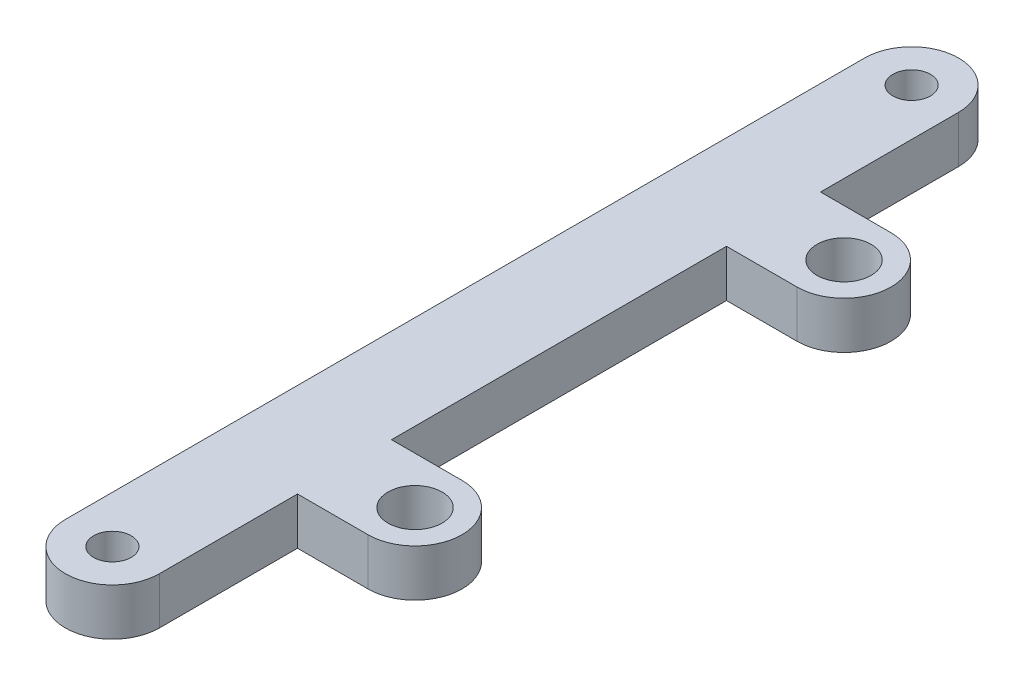
from build123d import *

# Parameters (mm, degrees)
SKETCH1_R           = 1.6
SKETCH1_R_2         = 2.3
BOSS_EXTRUDE1_DEPTH = 4


with BuildPart() as part:
    # Sketch1 → Boss-Extrude1 (new body)
    with BuildSketch(Plane(origin=(0, 0, 0), x_dir=(1, 0, 0), z_dir=(0, 1, 0))):
        with BuildLine():
            Line((-4, 68), (-4, 0))
            ThreePointArc((-4, 0), (0, -4), (4, 0))
            Line((4, 0), (4, 11.75))
            Line((4, 11.75), (10, 11.75))
            ThreePointArc((10, 11.75), (14, 15.75), (10, 19.75))
            Line((10, 19.75), (4, 19.75))
            Line((4, 19.75), (4, 48.25))
            Line((4, 48.25), (10, 48.25))
            ThreePointArc((10, 48.25), (14, 52.25), (10, 56.25))
            Line((10, 56.25), (4, 56.25))
            Line((4, 56.25), (4, 68))
            ThreePointArc((4, 68), (0, 72), (-4, 68))
        make_face()
        with Locations(Location((0, 68, 0), (0, 0, 270))):
            Circle(SKETCH1_R, mode=Mode.SUBTRACT)
        with Locations(Location((0, 0, 0), (0, 0, 270))):
            Circle(SKETCH1_R, mode=Mode.SUBTRACT)
        with Locations(Location((10, 52.25, 0), (0, 0, 270))):
            Circle(SKETCH1_R_2, mode=Mode.SUBTRACT)
        with Locations(Location((10, 15.75, 0), (0, 0, 90))):
            Circle(SKETCH1_R_2, mode=Mode.SUBTRACT)
    extrude(amount=BOSS_EXTRUDE1_DEPTH)


solid = part.part
